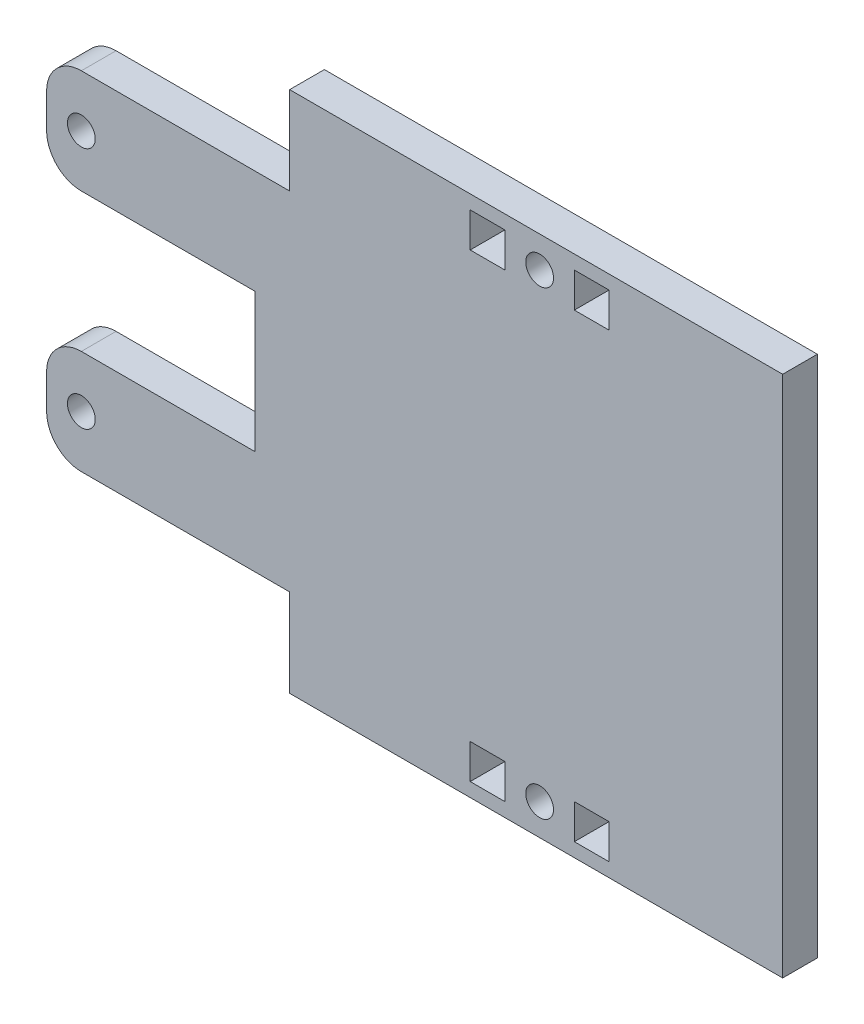
from build123d import *

# Parameters (mm, degrees)
ESQUISSE1_R        = 2
ESQUISSE1_W        = 5
ESQUISSE1_H        = 5
BOSS_EXTRU_1_DEPTH = 5
CONG_1_R           = 5


with BuildPart() as part:
    # Esquisse1 → Boss.-Extru.1 (new body)
    with BuildSketch(Plane.XY):
        Polygon((0, 37.65), (71, 37.65), (71, -37.65), (0, -37.65), (0, -25), (-35, -25), (-35, -10), (-5, -10), (-5, 10), (-35, 10), (-35, 25), (0, 25), align=None)
        with Locations((-30, 17.5)):
            Circle(ESQUISSE1_R, mode=Mode.SUBTRACT)
        with Locations(Location((-30, -17.5, 0), (0, 0, 180))):
            Circle(ESQUISSE1_R, mode=Mode.SUBTRACT)
        with Locations((36, 33.15)):
            Circle(ESQUISSE1_R, mode=Mode.SUBTRACT)
        with Locations(Location((36, -33.15, 0), (0, 0, 90))):
            Circle(ESQUISSE1_R, mode=Mode.SUBTRACT)
        with Locations((28.5, 33.15)):
            Rectangle(ESQUISSE1_W, ESQUISSE1_H, mode=Mode.SUBTRACT)
        with Locations((43.5, 33.15)):
            Rectangle(ESQUISSE1_W, ESQUISSE1_H, mode=Mode.SUBTRACT)
        with Locations((28.5, -33.15)):
            Rectangle(ESQUISSE1_W, ESQUISSE1_H, mode=Mode.SUBTRACT)
        with Locations((43.5, -33.15)):
            Rectangle(ESQUISSE1_W, ESQUISSE1_H, mode=Mode.SUBTRACT)
    extrude(amount=BOSS_EXTRU_1_DEPTH)

    # Congé1
    cong_1_edges = [part.edges().sort_by_distance(p)[0] for p in [
        (-35, -10, 2.5),
        (-35, 10, 2.5),
        (-35, 25, 2.5),
        (-35, -25, 2.5),
    ]]
    fillet(cong_1_edges, radius=CONG_1_R)


solid = part.part
